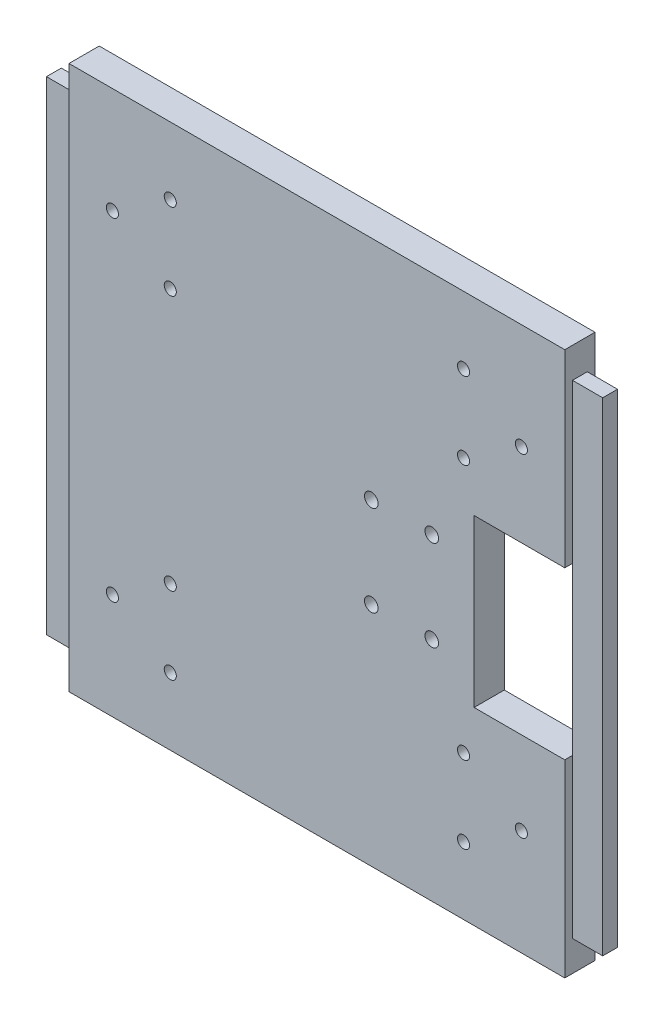
from build123d import *

# Parameters (mm, degrees)
SKETCH_1_W          = 164
SKETCH_1_H          = 180
EXTRUDE_1_DEPTH     = 10
SKETCH_2_W          = 4.9
SKETCH_2_H          = 159.9
EXTRUDE_2_DEPTH     = 10
SKETCH_3_R          = 2
CUT_EXTRUDE_1_DEPTH = 10
SKETCH_7_R          = 2.25
SKETCH_7_W          = 30
SKETCH_7_H          = 55
CUT_EXTRUDE_5_DEPTH = 251.551391934


with BuildPart() as part:
    # 草图1 → 凸台-拉伸1 (new body)
    with BuildSketch(Plane.XY):
        with Locations((82, 90)):
            Rectangle(SKETCH_1_W, SKETCH_1_H)
    extrude(amount=EXTRUDE_1_DEPTH)

    # 草图2 → 凸台-拉伸2 (add)
    with BuildSketch(Plane.ZY):
        with Locations((5, 90)):
            Rectangle(SKETCH_2_W, SKETCH_2_H)
    extrude_2 = extrude(amount=EXTRUDE_2_DEPTH)

    # 镜向1: 凸台-拉伸2 across plane
    add(extrude_2.mirror(Plane(origin=(82, 0, 0), x_dir=(0, 0, 1), z_dir=(1, 0, 0))))

    # 草图3 → 切除-拉伸1 (cut)
    with BuildSketch(Plane(origin=(0, 0, 0), x_dir=(-1, 0, 0), z_dir=(0, 0, -1))):
        with Locations((-149.6425573, 145)):
            Circle(SKETCH_3_R)
        with Locations((-130.5, 157.75)):
            Circle(SKETCH_3_R)
        with Locations((-130.5, 132.25)):
            Circle(SKETCH_3_R)
        with Locations((-14.3574427, 145)):
            Circle(SKETCH_3_R)
        with Locations((-33.5, 157.75)):
            Circle(SKETCH_3_R)
        with Locations((-33.5, 132.25)):
            Circle(SKETCH_3_R)
        with Locations(Location((-130.5, 47.75, 0), (0, 0, 180))):
            Circle(SKETCH_3_R)
        with Locations(Location((-130.5, 22.25, 0), (0, 0, 180))):
            Circle(SKETCH_3_R)
        with Locations(Location((-149.6425573, 35, 0), (0, 0, 180))):
            Circle(SKETCH_3_R)
        with Locations(Location((-33.5, 47.75, 0), (0, 0, 180))):
            Circle(SKETCH_3_R)
        with Locations(Location((-33.5, 22.25, 0), (0, 0, 180))):
            Circle(SKETCH_3_R)
        with Locations(Location((-14.3574427, 35, 0), (0, 0, 180))):
            Circle(SKETCH_3_R)
    extrude(amount=-CUT_EXTRUDE_1_DEPTH, mode=Mode.SUBTRACT)

    # 草图7 → 切除-拉伸5 (cut, through all)
    with BuildSketch(Plane.XY.offset(10)):
        with Locations((120, 105)):
            Circle(SKETCH_7_R)
        with Locations((120, 75)):
            Circle(SKETCH_7_R)
        with Locations((100, 105)):
            Circle(SKETCH_7_R)
        with Locations((100, 75)):
            Circle(SKETCH_7_R)
        with Locations((149, 90)):
            Rectangle(SKETCH_7_W, SKETCH_7_H)
    extrude(amount=-CUT_EXTRUDE_5_DEPTH, mode=Mode.SUBTRACT)


solid = part.part
